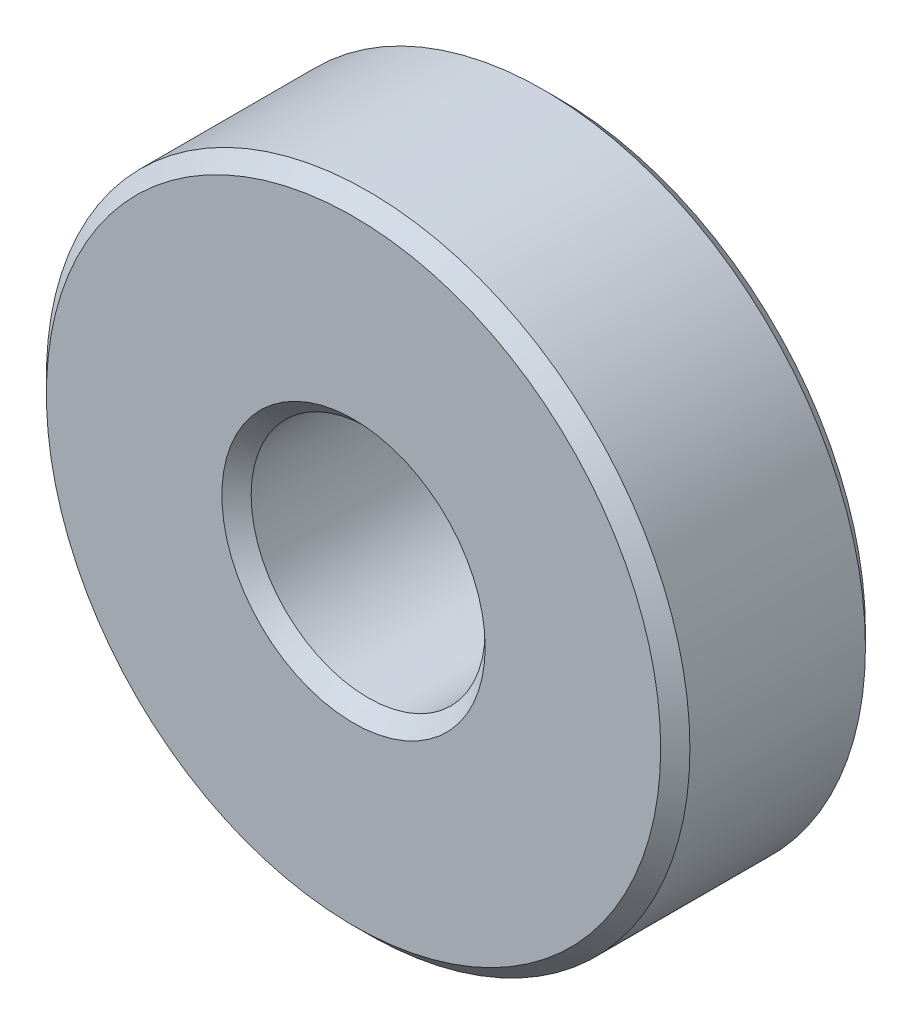
from build123d import *

# Parameters (mm, degrees)
SZKIC1_R                    = 11
SZKIC1_R_2                  = 4
DODANIE_WYCI_GNI_CIE1_DEPTH = 7
SFAZOWANIE1_SIZE            = 0.5


with BuildPart() as part:
    # Szkic1 → Dodanie-wyciągnięcie1 (new body)
    with BuildSketch(Plane.XY):
        Circle(SZKIC1_R)
        Circle(SZKIC1_R_2, mode=Mode.SUBTRACT)
    extrude(amount=DODANIE_WYCI_GNI_CIE1_DEPTH)

    # Sfazowanie1
    sfazowanie1_edges = [part.edges().sort_by_distance(p)[0] for p in [
        (-11, 0, 0),
        (-11, 0, 7),
        (-4, 0, 0),
        (-4, 0, 7),
    ]]
    chamfer(sfazowanie1_edges, length=SFAZOWANIE1_SIZE)


solid = part.part
